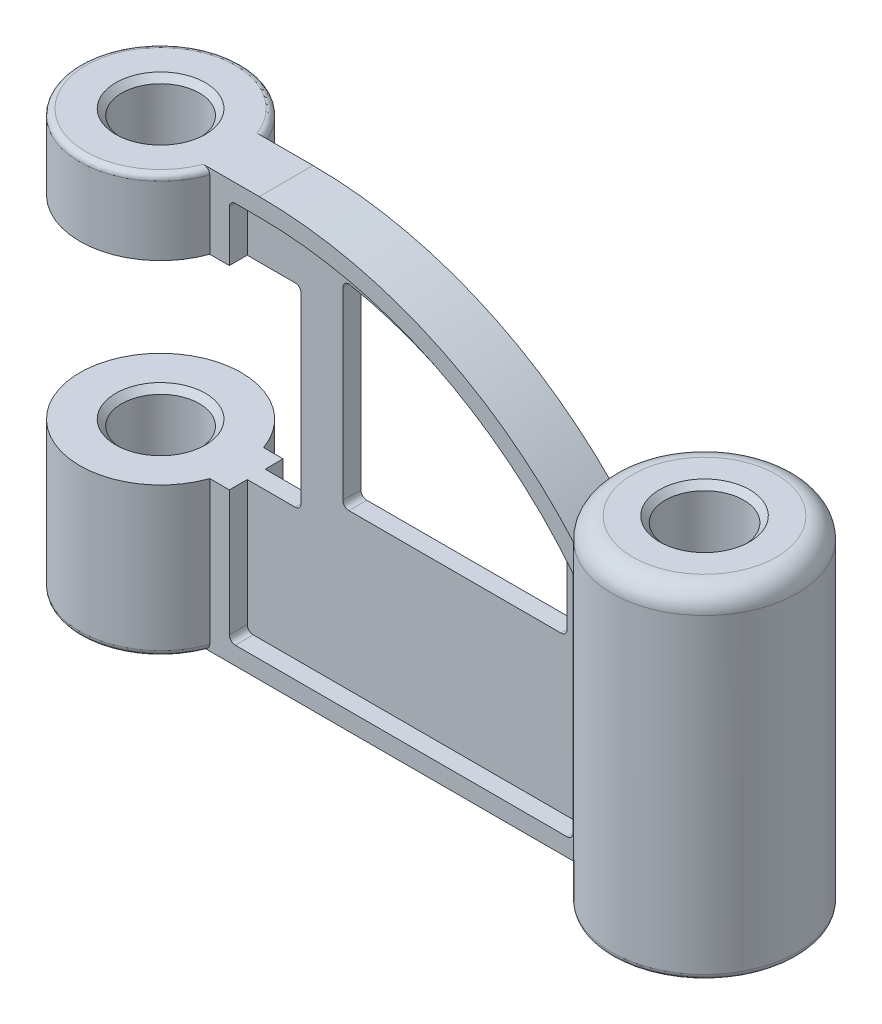
from build123d import *

# Parameters (mm, degrees)
CUT_EXTRUDE_8_DEPTH      = 184.806963974
EXTRUDE_1_DEPTH          = 9
EXTRUDE_1_DEPTH_BACK     = 9
EXTRUDE_2_DEPTH          = 3
EXTRUDE_2_DEPTH_BACK     = 3
SKETCH_2_R               = 13
SKETCH_2_R_2             = 13.100880905
CUT_EXTRUDE_7_DEPTH      = 190.570567491
CUT_EXTRUDE_9_DEPTH      = 190.570567491
CUT_EXTRUDE_9_DEPTH_BACK = 190.570567491
CHAMFER_4_SIZE           = 2
CHAMFER_5_SIZE           = 2
CHAMFER_6_SIZE           = 2


with BuildPart() as part:
    # Эскиз1 → Повернуть1 (revolve)
    with BuildSketch(Plane.XY, mode=Mode.PRIVATE) as revolve_1_sk:
        with BuildLine():
            Line((-62, 2), (-62, 138))
            ThreePointArc((-62, 138), (-62.585786438, 139.414213562), (-64, 140))
            Line((-64, 140), (-89, 140))
            Line((-89, 140), (-89, 0))
            Line((-89, 0), (-64, 0))
            ThreePointArc((-64, 0), (-62.585786438, 0.585786438), (-62, 2))
        make_face()
    revolve(revolve_1_sk.sketch.rotate(Axis((-89, 140, 0), (0, -1, 0)), 180), axis=Axis((-89, 140, 0), (0, -1, 0)))

    # Эскиз5 → Вырез-Вытянуть8 (cut, through all)
    with BuildSketch(Plane.XY):
        with BuildLine():
            Line((-116, 115), (-41, 115))
            ThreePointArc((-41, 115), (-39.585786438, 114.414213562), (-39, 113))
            Line((-39, 113), (-39, 52))
            ThreePointArc((-39, 52), (-39.585786438, 50.585786438), (-41, 50))
            Line((-41, 50), (-116, 50))
            Line((-116, 50), (-116, 115))
        make_face()
        with BuildLine():
            Line((50, 79.693161564), (50, 60))
            ThreePointArc((50, 60), (49.414213562, 58.585786438), (48, 58))
            Line((48, 58), (-23, 58))
            ThreePointArc((-23, 58), (-24.414213562, 58.585786438), (-25, 60))
            Line((-25, 60), (-25, 121.655250606))
            ThreePointArc((-25, 121.655250606), (-24.27000127, 123.200273834), (-22.612903226, 123.617432067))
            ThreePointArc((-22.612903226, 123.617432067), (17.108435299, 108.471694573), (49.532258065, 80.978535137))
            ThreePointArc((49.532258065, 80.978535137), (49.87943025, 80.377078178), (50, 79.693161564))
        make_face()
    extrude(amount=-CUT_EXTRUDE_8_DEPTH, mode=Mode.SUBTRACT)



with BuildPart() as body_2:
    # Эскиз1<4> → Повернуть2 (revolve)
    with BuildSketch(Plane.XY, mode=Mode.PRIVATE) as revolve_2_sk:
        with BuildLine():
            Line((62, 2), (62, 106))
            ThreePointArc((62, 106), (64.050252532, 110.949747468), (69, 113))
            Line((69, 113), (93, 113))
            Line((93, 113), (93, 0))
            Line((93, 0), (64, 0))
            ThreePointArc((64, 0), (62.585786438, 0.585786438), (62, 2))
        make_face()
    revolve(revolve_2_sk.sketch.rotate(Axis((93, 113, 0), (0, -1, 0)), 270), axis=Axis((93, 113, 0), (0, -1, 0)))


with BuildPart() as part_1:
    add(part.part)

    add(body_2.part)  # Бобышка-Вытянуть1 merges body 2
    # Эскиз1<5> → Бобышка-Вытянуть1 (add, two sides: drawn at the far end of the back side and taken through both)
    # profile 1 of 3: a face of its own
    with BuildSketch(Plane.XY.offset(-EXTRUDE_1_DEPTH_BACK)):
        with BuildLine():
            ThreePointArc((-62, 2), (-62.585786438, 0.585786438), (-64, 0))
            Line((-64, 0), (-47, 0))
            Line((-47, 0), (64, 0))
            ThreePointArc((64, 0), (62.585786438, 0.585786438), (62, 2))
            Line((62, 2), (62, 87.857839718))
            ThreePointArc((62, 87.857839718), (13.414826158, 126.293502526), (-47, 140))
            Line((-47, 140), (-64, 140))
            ThreePointArc((-64, 140), (-62.585786438, 139.414213562), (-62, 138))
            Line((-62, 138), (-62, 2))
        make_face()
        with BuildLine():
            Line((56, 6), (-47, 6))
            Line((-47, 6), (-55, 6))
            ThreePointArc((-55, 6), (-56.414213562, 6.585786438), (-57, 8))
            Line((-57, 8), (-57, 132))
            ThreePointArc((-57, 132), (-56.414213562, 133.414213562), (-55, 134))
            Line((-55, 134), (-47, 134))
            ThreePointArc((-47, 134), (10.992622758, 120.800892818), (57.560606061, 83.803816502))
            ThreePointArc((57.560606061, 83.803816502), (57.886956825, 83.215881236), (58, 82.55301327))
            Line((58, 82.55301327), (58, 8))
            ThreePointArc((58, 8), (57.414213562, 6.585786438), (56, 6))
        make_face(mode=Mode.SUBTRACT)
    # profile 2 of 3: a face of its own
    with BuildSketch(Plane.XY.offset(-EXTRUDE_1_DEPTH_BACK)):
        with BuildLine():
            Line((-89, 0), (-64, 0))
            ThreePointArc((-64, 0), (-62.585786438, 0.585786438), (-62, 2))
            Line((-62, 2), (-62, 138))
            ThreePointArc((-62, 138), (-62.585786438, 139.414213562), (-64, 140))
            Line((-64, 140), (-89, 140))
            Line((-89, 140), (-89, 0))
        make_face()
    # profile 3 of 3: a face of its own
    with BuildSketch(Plane.XY.offset(-EXTRUDE_1_DEPTH_BACK)):
        with BuildLine():
            ThreePointArc((62, 2), (62.585786438, 0.585786438), (64, 0))
            Line((64, 0), (93, 0))
            ThreePointArc((93, 0), (85.022725317, 46.583258795), (62, 87.857839718))
            Line((62, 87.857839718), (62, 2))
        make_face()
    extrude(amount=EXTRUDE_1_DEPTH + EXTRUDE_1_DEPTH_BACK)

    # Эскиз1<6> → Бобышка-Вытянуть2 (add, two sides: drawn at the far end of the back side and taken through both)
    with BuildSketch(Plane.XY.offset(-EXTRUDE_2_DEPTH_BACK)):
        with BuildLine():
            Line((-47, 134), (-47, 6))
            Line((-47, 6), (56, 6))
            ThreePointArc((56, 6), (57.414213562, 6.585786438), (58, 8))
            Line((58, 8), (58, 82.55301327))
            ThreePointArc((58, 82.55301327), (57.886956825, 83.215881236), (57.560606061, 83.803816502))
            ThreePointArc((57.560606061, 83.803816502), (10.992622758, 120.800892818), (-47, 134))
        make_face()
        with BuildLine():
            Line((-55, 6), (-47, 6))
            Line((-47, 6), (-47, 134))
            Line((-47, 134), (-55, 134))
            ThreePointArc((-55, 134), (-56.414213562, 133.414213562), (-57, 132))
            Line((-57, 132), (-57, 8))
            ThreePointArc((-57, 8), (-56.414213562, 6.585786438), (-55, 6))
        make_face()
    extrude(amount=EXTRUDE_2_DEPTH + EXTRUDE_2_DEPTH_BACK)

    # Эскиз2 → Вырез-Вытянуть7 (cut, through all)
    with BuildSketch(Plane(origin=(0, 0, 0), x_dir=(1, 0, 0), z_dir=(0, 1, 0))):
        with Locations(Location((-89, 0, 0), (0, 0, 270))):
            Circle(SKETCH_2_R)
        with Locations(Location((93, 0, 0), (0, 0, 90))):
            Circle(SKETCH_2_R_2)
    extrude(amount=CUT_EXTRUDE_7_DEPTH, mode=Mode.SUBTRACT)

    # Эскиз5<2> → Вырез-Вытянуть9 (cut, two sides: drawn at the far end of the back side and taken through both)
    with BuildSketch(Plane.XY.offset(-CUT_EXTRUDE_9_DEPTH_BACK)):
        with BuildLine():
            Line((-116, 115), (-41, 115))
            ThreePointArc((-41, 115), (-39.585786438, 114.414213562), (-39, 113))
            Line((-39, 113), (-39, 52))
            ThreePointArc((-39, 52), (-39.585786438, 50.585786438), (-41, 50))
            Line((-41, 50), (-116, 50))
            Line((-116, 50), (-116, 115))
        make_face()
        with BuildLine():
            Line((50, 79.693161564), (50, 60))
            ThreePointArc((50, 60), (49.414213562, 58.585786438), (48, 58))
            Line((48, 58), (-23, 58))
            ThreePointArc((-23, 58), (-24.414213562, 58.585786438), (-25, 60))
            Line((-25, 60), (-25, 121.655250606))
            ThreePointArc((-25, 121.655250606), (-24.27000127, 123.200273834), (-22.612903226, 123.617432067))
            ThreePointArc((-22.612903226, 123.617432067), (17.108435299, 108.471694573), (49.532258065, 80.978535137))
            ThreePointArc((49.532258065, 80.978535137), (49.87943025, 80.377078178), (50, 79.693161564))
        make_face()
    extrude(amount=CUT_EXTRUDE_9_DEPTH + CUT_EXTRUDE_9_DEPTH_BACK, mode=Mode.SUBTRACT)

    # Фаска4
    chamfer_4_edges = [part_1.edges().sort_by_distance(p)[0] for p in [
        (93, 0, 13.100880905),
        (93, 113, 13.100880905),
    ]]
    chamfer(chamfer_4_edges, length=CHAMFER_4_SIZE)

    # Фаска5
    chamfer_5_edges = [part_1.edges().sort_by_distance(p)[0] for p in [
        (-89, 115, -13),
        (-89, 140, -13),
    ]]
    chamfer(chamfer_5_edges, length=CHAMFER_5_SIZE)

    # Фаска6
    chamfer_6_edges = [part_1.edges().sort_by_distance(p)[0] for p in [
        (-89, 0, -13),
        (-89, 50, -13),
    ]]
    chamfer(chamfer_6_edges, length=CHAMFER_6_SIZE)


solid = part_1.part
